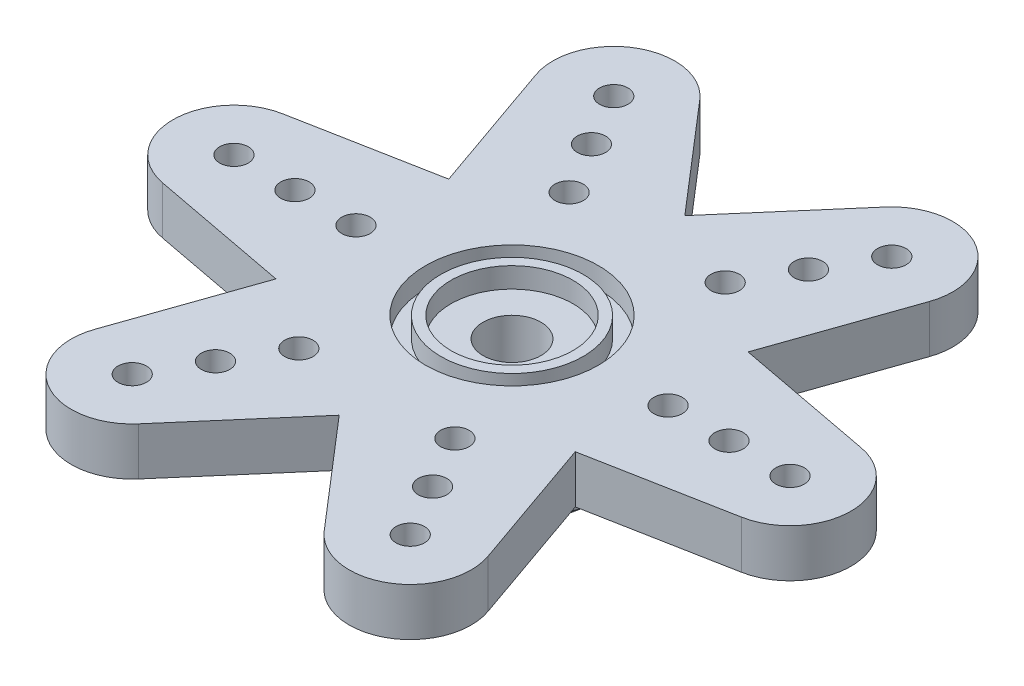
from build123d import *

# Parameters (mm, degrees)
SKETCH_1_R          = 0.7
EXTRUDE_1_DEPTH     = 2.35
SKETCH_2_R          = 4.4
SKETCH_2_R_2        = 1.425
EXTRUDE_2_DEPTH     = 3.5
SKETCH_3_R          = 1.425
CUT_EXTRUDE_1_DEPTH = 23.59684111
SKETCH_4_R          = 3
SKETCH_4_R_2        = 1.425
CUT_EXTRUDE_2_DEPTH = 1
SKETCH_4_3_R        = 4.25
SKETCH_4_3_R_2      = 3.5
CUT_EXTRUDE_3_DEPTH = 1
CHAMFER_1_SIZE      = 0.25


with BuildPart() as part:
    # 草图1 → 凸台-拉伸1 (new body)
    with BuildSketch(Plane(origin=(0, 0, 0), x_dir=(1, 0, 0), z_dir=(0, 1, 0))):
        with BuildLine():
            Line((-7.361215932, -4.25), (-14.233620573, -2.947531689))
            ThreePointArc((-14.233620573, -2.947531689), (-16.675, 0), (-14.233620573, 2.947531689))
            Line((-14.233620573, 2.947531689), (-7.361215932, 4.25))
            Line((-7.361215932, 4.25), (-9.669447607, 10.85291116))
            ThreePointArc((-9.669447607, 10.85291116), (-8.3375, 14.440973608), (-4.564172966, 13.800442848))
            Line((-4.564172966, 13.800442848), (0, 8.499999999))
            Line((0, 8.499999999), (4.564172966, 13.800442848))
            ThreePointArc((4.564172966, 13.800442848), (8.3375, 14.440973608), (9.669447607, 10.852911159))
            Line((9.669447607, 10.852911159), (7.361215932, 4.25))
            Line((7.361215932, 4.25), (14.233620573, 2.947531688))
            ThreePointArc((14.233620573, 2.947531688), (16.675, -1e-09), (14.233620573, -2.947531689))
            Line((14.233620573, -2.947531689), (7.361215932, -4.25))
            Line((7.361215932, -4.25), (9.669447607, -10.852911161))
            ThreePointArc((9.669447607, -10.852911161), (8.337499999, -14.440973608), (4.564172965, -13.800442849))
            Line((4.564172965, -13.800442849), (0, -8.5))
            Line((0, -8.5), (-4.564172966, -13.800442849))
            ThreePointArc((-4.564172966, -13.800442849), (-8.3375, -14.440973608), (-9.669447608, -10.85291116))
            Line((-9.669447608, -10.85291116), (-7.361215932, -4.25))
        make_face()
        with Locations((-13.675, 0)):
            Circle(SKETCH_1_R, mode=Mode.SUBTRACT)
        with Locations((-10.675, 0)):
            Circle(SKETCH_1_R, mode=Mode.SUBTRACT)
        with Locations((-7.675, 0)):
            Circle(SKETCH_1_R, mode=Mode.SUBTRACT)
        with Locations((-6.8375, 11.842897397)):
            Circle(SKETCH_1_R, mode=Mode.SUBTRACT)
        with Locations((-5.3375, 9.244821185)):
            Circle(SKETCH_1_R, mode=Mode.SUBTRACT)
        with Locations((-3.8375, 6.646744974)):
            Circle(SKETCH_1_R, mode=Mode.SUBTRACT)
        with Locations((6.8375, 11.842897397)):
            Circle(SKETCH_1_R, mode=Mode.SUBTRACT)
        with Locations((5.3375, 9.244821185)):
            Circle(SKETCH_1_R, mode=Mode.SUBTRACT)
        with Locations((3.8375, 6.646744974)):
            Circle(SKETCH_1_R, mode=Mode.SUBTRACT)
        with Locations((13.675, 0)):
            Circle(SKETCH_1_R, mode=Mode.SUBTRACT)
        with Locations((10.675, 0)):
            Circle(SKETCH_1_R, mode=Mode.SUBTRACT)
        with Locations((7.675, 0)):
            Circle(SKETCH_1_R, mode=Mode.SUBTRACT)
        with Locations((6.8375, -11.842897397)):
            Circle(SKETCH_1_R, mode=Mode.SUBTRACT)
        with Locations((5.3375, -9.244821185)):
            Circle(SKETCH_1_R, mode=Mode.SUBTRACT)
        with Locations((3.8375, -6.646744974)):
            Circle(SKETCH_1_R, mode=Mode.SUBTRACT)
        with Locations((-6.8375, -11.842897397)):
            Circle(SKETCH_1_R, mode=Mode.SUBTRACT)
        with Locations((-5.3375, -9.244821185)):
            Circle(SKETCH_1_R, mode=Mode.SUBTRACT)
        with Locations((-3.8375, -6.646744974)):
            Circle(SKETCH_1_R, mode=Mode.SUBTRACT)
    extrude(amount=EXTRUDE_1_DEPTH)

    # 草图2 → 凸台-拉伸2 (add)
    with BuildSketch(Plane.XZ):
        Circle(SKETCH_2_R)
        Circle(SKETCH_2_R_2, mode=Mode.SUBTRACT)
    extrude(amount=EXTRUDE_2_DEPTH)

    # 草图3 → 切除-拉伸1 (cut, through all)
    with BuildSketch(Plane.XZ):
        Circle(SKETCH_3_R)
    extrude(amount=-CUT_EXTRUDE_1_DEPTH, mode=Mode.SUBTRACT)

    # 草图4 → 切除-拉伸2 (cut)
    with BuildSketch(Plane(origin=(0, 2.35, 0), x_dir=(1, 0, 0), z_dir=(0, 1, 0))):
        Circle(SKETCH_4_R)
        Circle(SKETCH_4_R_2, mode=Mode.SUBTRACT)
    extrude(amount=-CUT_EXTRUDE_2_DEPTH, mode=Mode.SUBTRACT)

    # 草图4<3> → 切除-拉伸3 (cut)
    with BuildSketch(Plane(origin=(0, 2.35, 0), x_dir=(1, 0, 0), z_dir=(0, 1, 0))):
        Circle(SKETCH_4_3_R)
        Circle(SKETCH_4_3_R_2, mode=Mode.SUBTRACT)
    extrude(amount=-CUT_EXTRUDE_3_DEPTH, mode=Mode.SUBTRACT)

    # 倒角1
    chamfer_1_edges = [part.edges().sort_by_distance(p)[0] for p in [
        (-4.4, -3.5, 0),
    ]]
    chamfer(chamfer_1_edges, length=CHAMFER_1_SIZE)


solid = part.part
